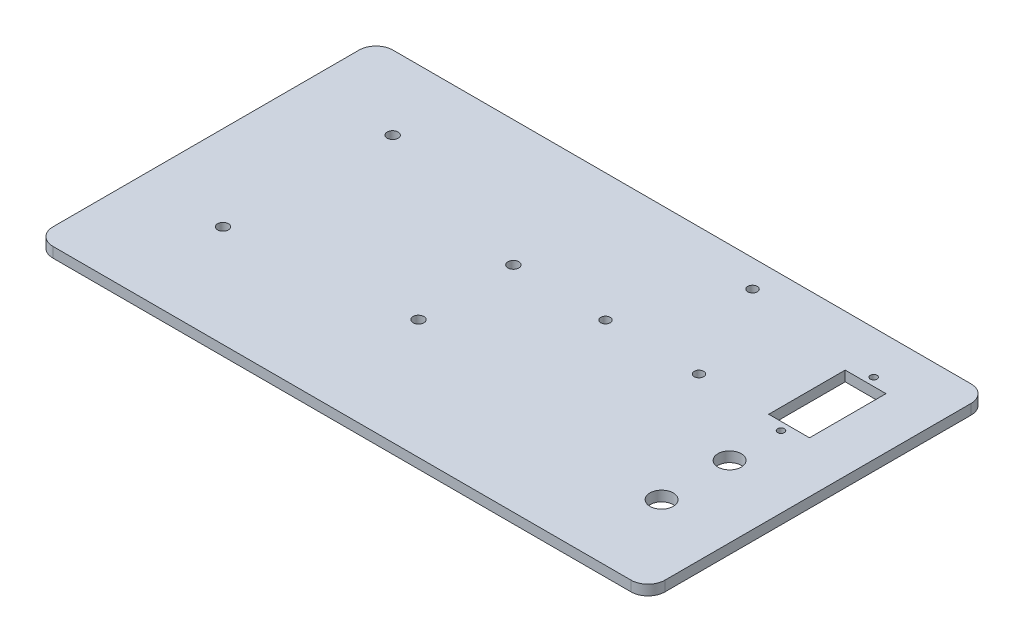
from build123d import *

# Parameters (mm, degrees)
SKETCH1_W           = 180
SKETCH1_H           = 100
BOSS_EXTRUDE1_DEPTH = 3
SKETCH2_R           = 1.6
CUT_EXTRUDE1_DEPTH  = 10
FILLET1_R           = 5
SKETCH3_R           = 1
SKETCH3_R_2         = 3.43
SKETCH3_R_3         = 1.4
SKETCH3_W           = 12
SKETCH3_H           = 22.5
CUT_EXTRUDE2_DEPTH  = 3


with BuildPart() as part:
    # Sketch1 → Boss-Extrude1 (new body)
    with BuildSketch(Plane(origin=(0, 0, 0), x_dir=(1, 0, 0), z_dir=(0, 1, 0))):
        Rectangle(SKETCH1_W, SKETCH1_H)
    extrude(amount=BOSS_EXTRUDE1_DEPTH)

    # Sketch2 → Cut-Extrude1 (cut)
    with BuildSketch(Plane(origin=(0, 3, 0), x_dir=(1, 0, 0), z_dir=(0, 1, 0))):
        with Locations(Location((-65, -20, 0), (0, 0, 270))):
            Circle(SKETCH2_R)
        with Locations(Location((-63.4, 28.3, 0), (0, 0, 270))):
            Circle(SKETCH2_R)
        with Locations(Location((-12.6, 13, 0), (0, 0, 270))):
            Circle(SKETCH2_R)
        with Locations(Location((-12.6, -14.9, 0), (0, 0, 270))):
            Circle(SKETCH2_R)
    extrude(amount=-CUT_EXTRUDE1_DEPTH, mode=Mode.SUBTRACT)

    # Fillet1
    fillet1_edges = [part.edges().sort_by_distance(p)[0] for p in [
        (90, 1.5, 50),
        (-90, 1.5, 50),
        (-90, 1.5, -50),
        (90, 1.5, -50),
    ]]
    fillet(fillet1_edges, radius=FILLET1_R)

    # Sketch3 → Cut-Extrude2 (cut)
    with BuildSketch(Plane(origin=(0, 3, 0), x_dir=(1, 0, 0), z_dir=(0, 1, 0))):
        with Locations(Location((69, 10.12, 0), (0, 0, 270))):
            Circle(SKETCH3_R)
        with Locations(Location((69, 37.38, 0), (0, 0, 270))):
            Circle(SKETCH3_R)
        with Locations(Location((69, -25, 0), (0, 0, 270))):
            Circle(SKETCH3_R_2)
        with Locations(Location((69, -5, 0), (0, 0, 270))):
            Circle(SKETCH3_R_2)
        with Locations(Location((42.5, 12.5, 0), (0, 0, 270))):
            Circle(SKETCH3_R_3)
        with Locations(Location((15, 12.5, 0), (0, 0, 270))):
            Circle(SKETCH3_R_3)
        with Locations(Location((28.75, 42, 0), (0, 0, 270))):
            Circle(SKETCH3_R_3)
        with Locations((69, 23.75)):
            Rectangle(SKETCH3_W, SKETCH3_H)
    extrude(amount=-CUT_EXTRUDE2_DEPTH, mode=Mode.SUBTRACT)


solid = part.part
